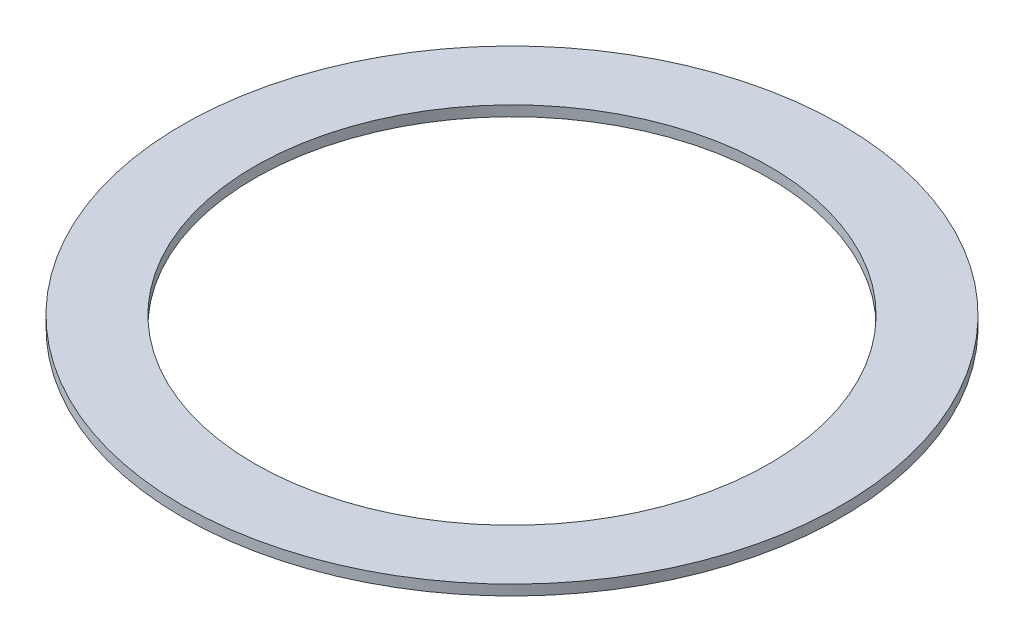
from build123d import *

# Parameters (mm, degrees)
ESQUISSE1_R        = 16
ESQUISSE1_R_2      = 12.5
BOSS_EXTRU_1_DEPTH = 0.5


with BuildPart() as part:
    # Esquisse1 → Boss.-Extru.1 (new body)
    with BuildSketch(Plane(origin=(0, 0, 0), x_dir=(1, 0, 0), z_dir=(0, 1, 0))):
        with Locations(Location((0, 0, 0), (0, 0, 270))):
            Circle(ESQUISSE1_R)
        with Locations(Location((0, 0, 0), (0, 0, 270))):
            Circle(ESQUISSE1_R_2, mode=Mode.SUBTRACT)
    extrude(amount=BOSS_EXTRU_1_DEPTH)


solid = part.part
